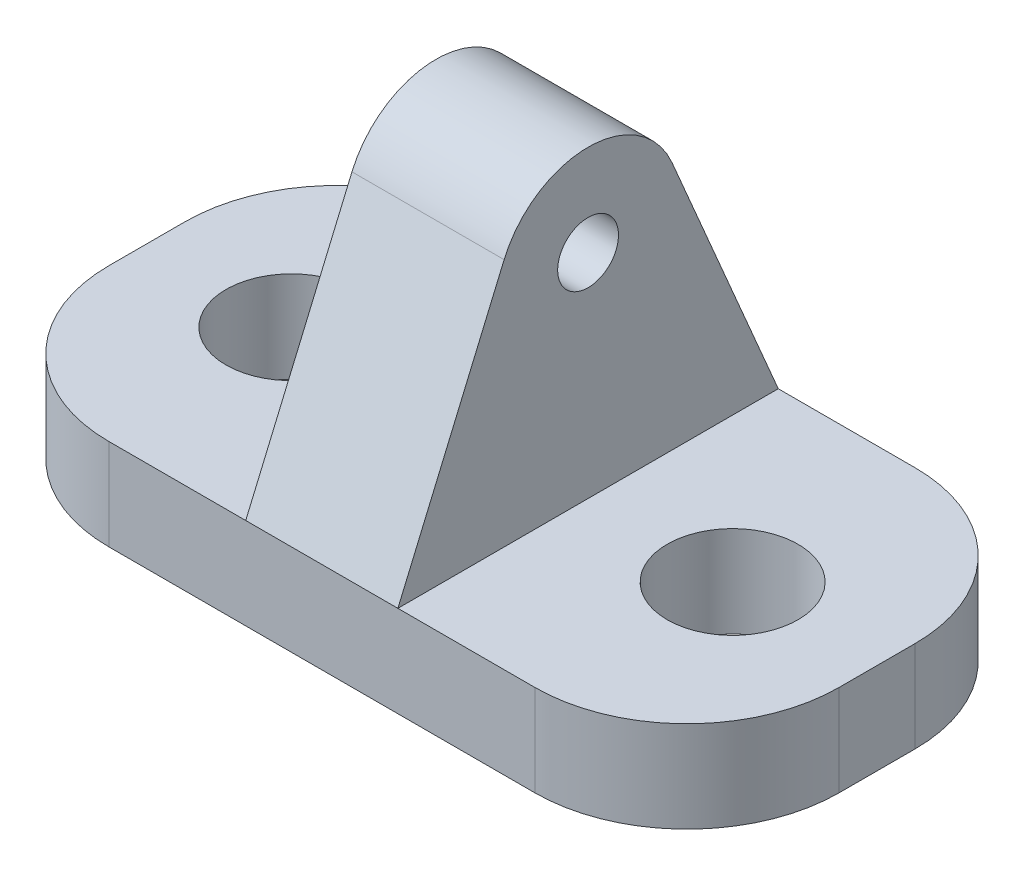
from build123d import *

# Parameters (mm, degrees)
SKETCH1_R               = 2.15
BOSS_EXTRUDE1_DEPTH     = 1.5
SKETCH3_W               = 5
SKETCH3_H               = 10
BOSS_EXTRUDE3_DEPTH     = 12.5
CUT_EXTRUDE1_DEPTH      = 20.533624856
CUT_EXTRUDE1_DEPTH_BACK = 20.533624856
SKETCH4_R               = 1


with BuildPart() as part:
    # Sketch1 → Boss-Extrude1 (new, symmetric)
    with BuildSketch(Plane(origin=(0, 0, 0), x_dir=(1, 0, 0), z_dir=(0, 1, 0))):
        with BuildLine():
            Line((-7, -6.25), (7, -6.25))
            ThreePointArc((7, -6.25), (10.535533906, -4.785533906), (12, -1.25))
            Line((12, -1.25), (12, 1.25))
            ThreePointArc((12, 1.25), (10.535533906, 4.785533906), (7, 6.25))
            Line((7, 6.25), (-7, 6.25))
            ThreePointArc((-7, 6.25), (-10.535533906, 4.785533906), (-12, 1.25))
            Line((-12, 1.25), (-12, -1.25))
            ThreePointArc((-12, -1.25), (-10.535533906, -4.785533906), (-7, -6.25))
        make_face()
        with Locations(Location((-7.25, 0, 0), (0, 0, 270))):
            Circle(SKETCH1_R, mode=Mode.SUBTRACT)
        with Locations(Location((7.25, 0, 0), (0, 0, 270))):
            Circle(SKETCH1_R, mode=Mode.SUBTRACT)
    extrude(amount=BOSS_EXTRUDE1_DEPTH, both=True)

    # Sketch3 → Boss-Extrude3 (add)
    with BuildSketch(Plane.XY.offset(6.25)):
        with Locations((0, 6.5)):
            Rectangle(SKETCH3_W, SKETCH3_H)
    extrude(amount=-BOSS_EXTRUDE3_DEPTH)

    # Sketch4 → Cut-Extrude1 (cut, two sides: drawn at the far end of the back side and taken through both)
    with BuildSketch(Plane.ZY.offset(2.5).offset(-CUT_EXTRUDE1_DEPTH_BACK)):
        with BuildLine():
            Line((-6.25, 1.5), (-2.759130187, 9.677794809))
            ThreePointArc((-2.759130187, 9.677794809), (-1.653271843, 11.003336217), (0, 11.5))
            Line((0, 11.5), (-6.25, 11.5))
            Line((-6.25, 11.5), (-6.25, 1.5))
        make_face()
        with BuildLine():
            Line((6.25, 11.5), (0, 11.5))
            ThreePointArc((0, 11.5), (1.653271843, 11.003336217), (2.759130187, 9.677794809))
            Line((2.759130187, 9.677794809), (6.25, 1.5))
            Line((6.25, 1.5), (6.25, 11.5))
        make_face()
        with Locations((0, 8.5)):
            Circle(SKETCH4_R)
    extrude(amount=CUT_EXTRUDE1_DEPTH + CUT_EXTRUDE1_DEPTH_BACK, mode=Mode.SUBTRACT)


solid = part.part
